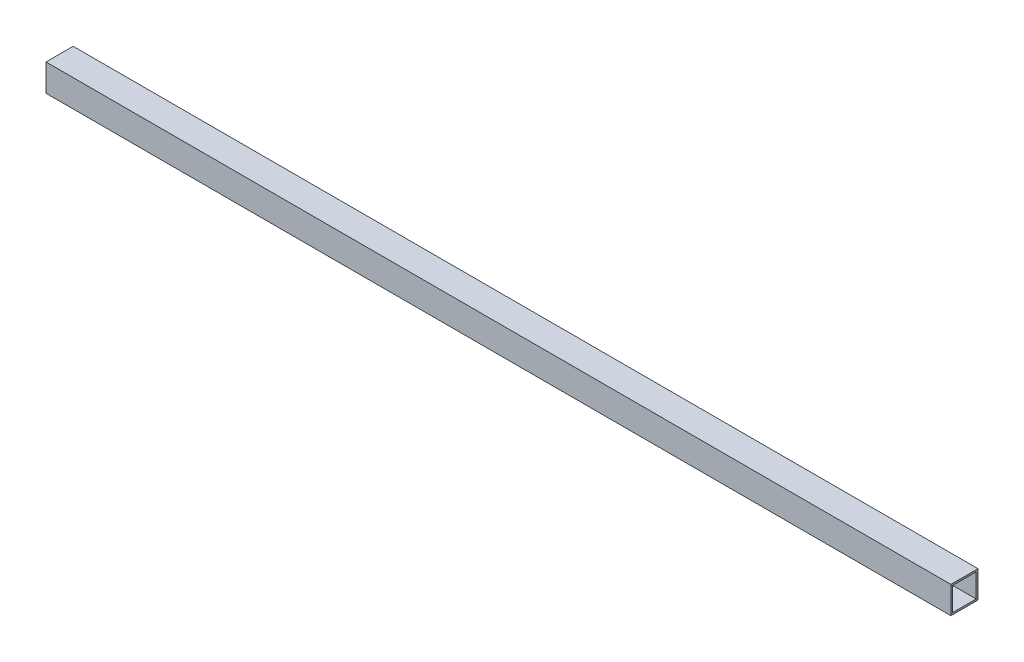
from build123d import *

# Parameters (mm, degrees)
SCHIZZO1_W                   = 15
SCHIZZO1_H                   = 15
SCHIZZO1_W_2                 = 13
SCHIZZO1_H_2                 = 13
ESTRUSIONE_ESTRUSIONE1_DEPTH = 500


with BuildPart() as part:
    # Schizzo1 → Estrusione-Estrusione1 (new body)
    with BuildSketch(Plane(origin=(0, 0, 0), x_dir=(0, 0, -1), z_dir=(1, 0, 0))):
        Rectangle(SCHIZZO1_W, SCHIZZO1_H)
        Rectangle(SCHIZZO1_W_2, SCHIZZO1_H_2, mode=Mode.SUBTRACT)
    extrude(amount=ESTRUSIONE_ESTRUSIONE1_DEPTH)


solid = part.part
